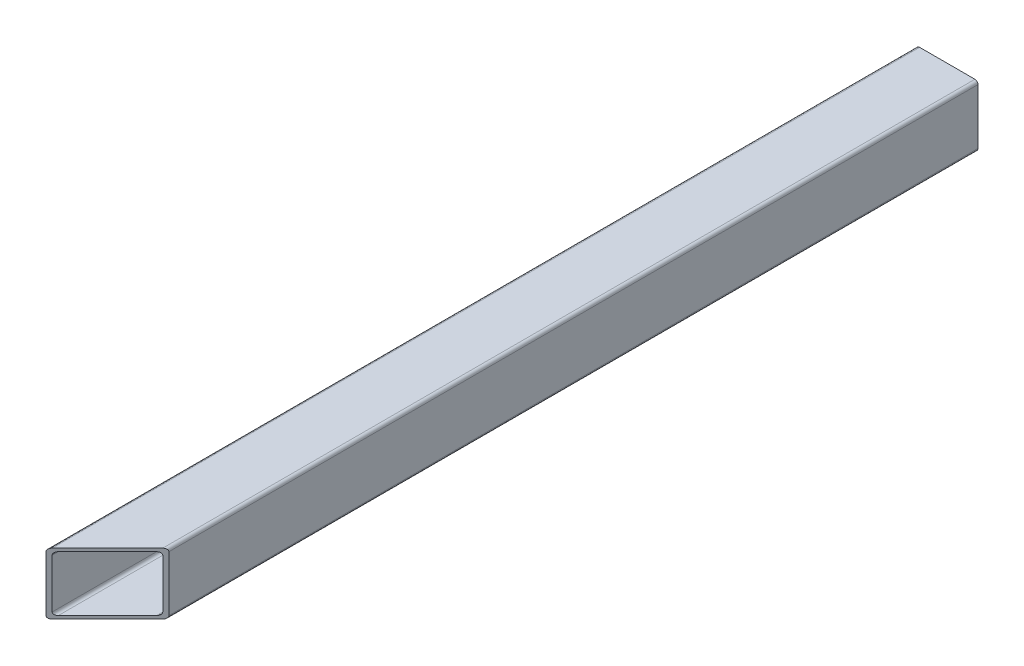
from build123d import *

# Parameters (mm, degrees)
DODANIE_WYCI_GNI_CIE1_DEPTH = 850
SZKIC3_W                    = 183.44852115
SZKIC3_H                    = 118.68309716
WYTNIJ_WYCI_GNI_CIE1_DEPTH  = 605.02814504


with BuildPart() as part:
    # Szkic2 → Dodanie-wyciągnięcie1 (new body)
    with BuildSketch(Plane.XY):
        with BuildLine():
            ThreePointArc((0, 57), (0.878679656, 59.121320344), (3, 60))
            Line((3, 60), (57, 60))
            ThreePointArc((57, 60), (59.121320344, 59.121320344), (60, 57))
            Line((60, 57), (60, 3))
            ThreePointArc((60, 3), (59.121320344, 0.878679656), (57, 0))
            Line((57, 0), (3, 0))
            ThreePointArc((3, 0), (0.878679656, 0.878679656), (0, 3))
            Line((0, 3), (0, 57))
        make_face()
        with BuildLine():
            Line((3, 6), (3, 54))
            ThreePointArc((3, 54), (3.878679656, 56.121320344), (6, 57))
            Line((6, 57), (54, 57))
            ThreePointArc((54, 57), (56.121320344, 56.121320344), (57, 54))
            Line((57, 54), (57, 6))
            ThreePointArc((57, 6), (56.121320344, 3.878679656), (54, 3))
            Line((54, 3), (6, 3))
            ThreePointArc((6, 3), (3.878679656, 3.878679656), (3, 6))
        make_face(mode=Mode.SUBTRACT)
    extrude(amount=DODANIE_WYCI_GNI_CIE1_DEPTH)

    # Szkic3 → Wytnij-wyciągnięcie1 (cut, through all)
    with BuildSketch(Plane(origin=(425, 0, 425), x_dir=(0, 1, 0), z_dir=(0.7071067811865488, 0, 0.7071067811865464))):
        with Locations((36.943590896, 573.417053453)):
            Rectangle(SZKIC3_W, SZKIC3_H)
    extrude(amount=WYTNIJ_WYCI_GNI_CIE1_DEPTH, mode=Mode.SUBTRACT)


solid = part.part
